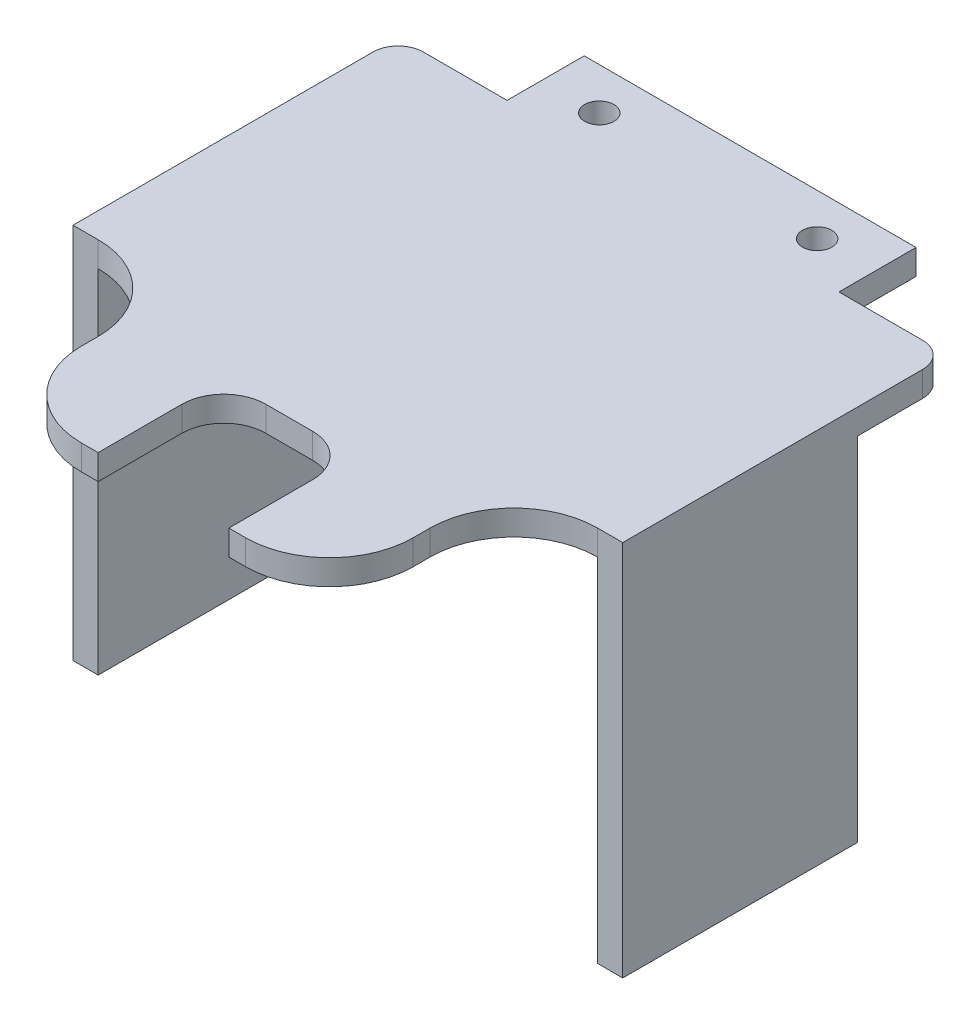
from build123d import *

# Parameters (mm, degrees)
SKETCH_1_W          = 39.6
SKETCH_1_H          = 70
EXTRUDE_1_DEPTH     = 3
HOLE_WIZARD_1_D     = 3.5
SKETCH_5_W          = 13
SKETCH_5_H          = 28
EXTRUDE_2_DEPTH     = 3
SKETCH_6_W          = 3
SKETCH_6_H          = 28
EXTRUDE_3_DEPTH     = 42
FILLET_1_R          = 10
FILLET_2_R          = 10
SKETCH_7_W          = 13
SKETCH_7_H          = 10.8
EXTRUDE_4_DEPTH     = 3
FILLET_4_R          = 3
SKETCH_8_W          = 15.6
SKETCH_8_H          = 15
CUT_EXTRUDE_1_DEPTH = 99.446736868
FILLET_5_R          = 5


with BuildPart() as part:
    # 草图1 → 凸台-拉伸1 (new body)
    with BuildSketch(Plane(origin=(0, 0, 0), x_dir=(1, 0, 0), z_dir=(0, 1, 0))):
        with Locations((19.8, 35)):
            Rectangle(SKETCH_1_W, SKETCH_1_H)
    extrude(amount=EXTRUDE_1_DEPTH)

    # 孔1 (through all)
    with Locations(Plane(origin=(0, 3, 0), x_dir=(1, 0, 0), z_dir=(0, 1, 0))):
        with Locations((6.8, 65), (32.8, 65)):
            Hole(HOLE_WIZARD_1_D / 2)

    # 草图5 → 凸台-拉伸2 (add)
    with BuildSketch(Plane(origin=(0, 3, 0), x_dir=(1, 0, 0), z_dir=(0, 1, 0))):
        with Locations((46.1, 36)):
            Rectangle(SKETCH_5_W, SKETCH_5_H)
        with Locations((-6.5, 36)):
            Rectangle(SKETCH_5_W, SKETCH_5_H)
    extrude(amount=-EXTRUDE_2_DEPTH)

    # 草图6 → 凸台-拉伸3 (add)
    with BuildSketch(Plane.XZ):
        with Locations((-11.5, -36)):
            Rectangle(SKETCH_6_W, SKETCH_6_H)
        with Locations((51.1, -36)):
            Rectangle(SKETCH_6_W, SKETCH_6_H)
    extrude(amount=EXTRUDE_3_DEPTH)

    # 圆角1
    fillet_1_edges = [part.edges().sort_by_distance(p)[0] for p in [
        (39.6, 1.5, -22),
        (0, 1.5, -22),
    ]]
    fillet(fillet_1_edges, radius=FILLET_1_R)

    # 圆角2
    fillet_2_edges = [part.edges().sort_by_distance(p)[0] for p in [
        (39.6, 1.5, 0),
        (0, 1.5, 0),
    ]]
    fillet(fillet_2_edges, radius=FILLET_2_R)

    # 草图7 → 凸台-拉伸4 (add)
    with BuildSketch(Plane(origin=(0, 3, 0), x_dir=(1, 0, 0), z_dir=(0, 1, 0))):
        with Locations((46.1, 55.4)):
            Rectangle(SKETCH_7_W, SKETCH_7_H)
        with Locations((-6.5, 55.4)):
            Rectangle(SKETCH_7_W, SKETCH_7_H)
    extrude(amount=-EXTRUDE_4_DEPTH)

    # 圆角4
    fillet_4_edges = [part.edges().sort_by_distance(p)[0] for p in [
        (52.6, 1.5, -60.8),
        (-13, 1.5, -60.8),
    ]]
    fillet(fillet_4_edges, radius=FILLET_4_R)

    # 草图8 → 切除-拉伸1 (cut, through all)
    with BuildSketch(Plane(origin=(0, 3, 0), x_dir=(1, 0, 0), z_dir=(0, 1, 0))):
        with Locations((19.8, 7.5)):
            Rectangle(SKETCH_8_W, SKETCH_8_H)
    extrude(amount=-CUT_EXTRUDE_1_DEPTH, mode=Mode.SUBTRACT)

    # 圆角5
    fillet_5_edges = [part.edges().sort_by_distance(p)[0] for p in [
        (12, 1.5, -15),
        (27.6, 1.5, -15),
    ]]
    fillet(fillet_5_edges, radius=FILLET_5_R)


solid = part.part
